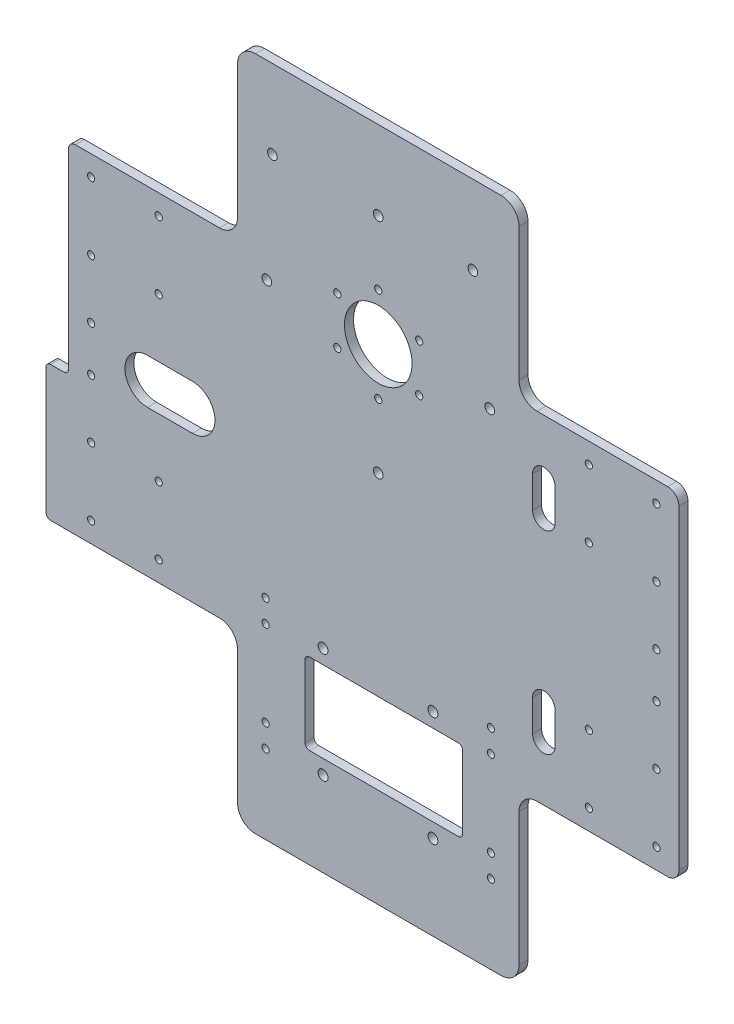
from build123d import *

# Parameters (mm, degrees)
SKETCH_281X300_10_R   = 1.6
SKETCH_281X300_10_R_2 = 15
SKETCH_281X300_10_R_3 = 2.15
SKETCH_281X300_10_R_4 = 2.2
F_4MM_DEPTH           = 4


with BuildPart() as part:
    # 底板轮廓_281x300_双槽内移10 → 凸台拉伸_4mm (new body)
    with BuildSketch(Plane.XY):
        with BuildLine():
            Line((-55.5, 83), (-55.5, 142))
            ThreePointArc((-55.5, 142), (-53.156854249, 147.656854249), (-47.5, 150))
            Line((-47.5, 150), (61.5, 150))
            ThreePointArc((61.5, 150), (67.156854249, 147.656854249), (69.5, 142))
            Line((69.5, 142), (69.5, 83))
            ThreePointArc((69.5, 83), (71.843145751, 77.343145751), (77.5, 75))
            Line((77.5, 75), (135.5, 75))
            ThreePointArc((135.5, 75), (139.035533906, 73.535533906), (140.5, 70))
            Line((140.5, 70), (140.5, -70))
            ThreePointArc((140.5, -70), (139.035533906, -73.535533906), (135.5, -75))
            Line((135.5, -75), (77.5, -75))
            ThreePointArc((77.5, -75), (71.843145751, -77.343145751), (69.5, -83))
            Line((69.5, -83), (69.5, -142))
            ThreePointArc((69.5, -142), (67.156854249, -147.656854249), (61.5, -150))
            Line((61.5, -150), (-47.5, -150))
            ThreePointArc((-47.5, -150), (-53.156854249, -147.656854249), (-55.5, -142))
            Line((-55.5, -142), (-55.5, -83))
            ThreePointArc((-55.5, -83), (-57.843145751, -77.343145751), (-63.5, -75))
            Line((-63.5, -75), (-138.5, -75))
            ThreePointArc((-138.5, -75), (-139.914213562, -74.414213562), (-140.5, -73))
            Line((-140.5, -73), (-140.5, -17))
            ThreePointArc((-140.5, -17), (-139.914213562, -15.585786438), (-138.5, -15))
            Line((-138.5, -15), (-132.5, -15))
            ThreePointArc((-132.5, -15), (-131.085786438, -14.414213562), (-130.5, -13))
            Line((-130.5, -13), (-130.5, 72))
            ThreePointArc((-130.5, 72), (-129.621320344, 74.121320344), (-127.5, 75))
            Line((-127.5, 75), (-63.5, 75))
            ThreePointArc((-63.5, 75), (-57.843145751, 77.343145751), (-55.5, 83))
        make_face()
        with Locations((100.5, -36)):
            Circle(SKETCH_281X300_10_R, mode=Mode.SUBTRACT)
        with Locations((130.5, -36)):
            Circle(SKETCH_281X300_10_R, mode=Mode.SUBTRACT)
        with Locations((100.5, 36)):
            Circle(SKETCH_281X300_10_R, mode=Mode.SUBTRACT)
        with Locations((7, 65.5)):
            Circle(SKETCH_281X300_10_R_2, mode=Mode.SUBTRACT)
        with Locations((7, 115)):
            Circle(SKETCH_281X300_10_R_3, mode=Mode.SUBTRACT)
        with Locations((-42.5, 65.5)):
            Circle(SKETCH_281X300_10_R_3, mode=Mode.SUBTRACT)
        with Locations((56.5, 65.5)):
            Circle(SKETCH_281X300_10_R_3, mode=Mode.SUBTRACT)
        with Locations((-40, 115)):
            Circle(SKETCH_281X300_10_R_3, mode=Mode.SUBTRACT)
        with Locations((130.5, 36)):
            Circle(SKETCH_281X300_10_R, mode=Mode.SUBTRACT)
        with Locations((49, 115)):
            Circle(SKETCH_281X300_10_R_3, mode=Mode.SUBTRACT)
        with Locations((7, 16)):
            Circle(SKETCH_281X300_10_R_3, mode=Mode.SUBTRACT)
        with Locations((31.290367902, -112.395183951)):
            Circle(SKETCH_281X300_10_R_4, mode=Mode.SUBTRACT)
        with Locations((-17.5, -112.395183951)):
            Circle(SKETCH_281X300_10_R_4, mode=Mode.SUBTRACT)
        with Locations((-17.5, -63.604816049)):
            Circle(SKETCH_281X300_10_R_4, mode=Mode.SUBTRACT)
        with Locations((31.290367902, -63.604816049)):
            Circle(SKETCH_281X300_10_R_4, mode=Mode.SUBTRACT)
        with Locations((7, 86.5)):
            Circle(SKETCH_281X300_10_R, mode=Mode.SUBTRACT)
        with Locations((25.186533479, 76)):
            Circle(SKETCH_281X300_10_R, mode=Mode.SUBTRACT)
        with Locations((100.5, -66)):
            Circle(SKETCH_281X300_10_R, mode=Mode.SUBTRACT)
        with Locations((25.186533479, 55)):
            Circle(SKETCH_281X300_10_R, mode=Mode.SUBTRACT)
        with Locations((100.5, 66)):
            Circle(SKETCH_281X300_10_R, mode=Mode.SUBTRACT)
        with Locations((7, 44.5)):
            Circle(SKETCH_281X300_10_R, mode=Mode.SUBTRACT)
        with Locations((130.5, 66)):
            Circle(SKETCH_281X300_10_R, mode=Mode.SUBTRACT)
        with Locations((130.5, -66)):
            Circle(SKETCH_281X300_10_R, mode=Mode.SUBTRACT)
        with Locations((-43, -105)):
            Circle(SKETCH_281X300_10_R, mode=Mode.SUBTRACT)
        with Locations((57, -57)):
            Circle(SKETCH_281X300_10_R, mode=Mode.SUBTRACT)
        with Locations((-43, -57)):
            Circle(SKETCH_281X300_10_R, mode=Mode.SUBTRACT)
        with Locations((57, -105)):
            Circle(SKETCH_281X300_10_R, mode=Mode.SUBTRACT)
        with Locations((-11.186533479, 55)):
            Circle(SKETCH_281X300_10_R, mode=Mode.SUBTRACT)
        with Locations((-11.186533479, 76)):
            Circle(SKETCH_281X300_10_R, mode=Mode.SUBTRACT)
        with Locations((130.5, 10)):
            Circle(SKETCH_281X300_10_R, mode=Mode.SUBTRACT)
        with Locations((130.5, -10)):
            Circle(SKETCH_281X300_10_R, mode=Mode.SUBTRACT)
        with Locations((-120.5, 10)):
            Circle(SKETCH_281X300_10_R, mode=Mode.SUBTRACT)
        with Locations((-120.5, -10)):
            Circle(SKETCH_281X300_10_R, mode=Mode.SUBTRACT)
        with Locations((-43, -115)):
            Circle(SKETCH_281X300_10_R, mode=Mode.SUBTRACT)
        with Locations((57, -67)):
            Circle(SKETCH_281X300_10_R, mode=Mode.SUBTRACT)
        with Locations((57, -115)):
            Circle(SKETCH_281X300_10_R, mode=Mode.SUBTRACT)
        with Locations((-43, -67)):
            Circle(SKETCH_281X300_10_R, mode=Mode.SUBTRACT)
        with Locations((-120.5, -66)):
            Circle(SKETCH_281X300_10_R, mode=Mode.SUBTRACT)
        with Locations((-90.5, -66)):
            Circle(SKETCH_281X300_10_R, mode=Mode.SUBTRACT)
        with Locations((-120.5, 66)):
            Circle(SKETCH_281X300_10_R, mode=Mode.SUBTRACT)
        with Locations((-90.5, 66)):
            Circle(SKETCH_281X300_10_R, mode=Mode.SUBTRACT)
        with Locations((-90.5, 36)):
            Circle(SKETCH_281X300_10_R, mode=Mode.SUBTRACT)
        with Locations((-120.5, 36)):
            Circle(SKETCH_281X300_10_R, mode=Mode.SUBTRACT)
        with Locations((-90.5, -36)):
            Circle(SKETCH_281X300_10_R, mode=Mode.SUBTRACT)
        with Locations((-120.5, -36)):
            Circle(SKETCH_281X300_10_R, mode=Mode.SUBTRACT)
        with BuildLine():
            Line((-25.5, -72), (-25.5, -104))
            ThreePointArc((-25.5, -104), (-24.914213562, -105.414213562), (-23.5, -106))
            Line((-23.5, -106), (42.5, -106))
            ThreePointArc((42.5, -106), (43.914213562, -105.414213562), (44.5, -104))
            Line((44.5, -104), (44.5, -72))
            ThreePointArc((44.5, -72), (43.914213562, -70.585786438), (42.5, -70))
            Line((42.5, -70), (-23.5, -70))
            ThreePointArc((-23.5, -70), (-24.914213562, -70.585786438), (-25.5, -72))
        make_face(mode=Mode.SUBTRACT)
        with BuildLine():
            Line((75.5, 50), (75.5, 36))
            ThreePointArc((75.5, 36), (80.5, 31), (85.5, 36))
            Line((85.5, 36), (85.5, 50))
            ThreePointArc((85.5, 50), (80.5, 55), (75.5, 50))
        make_face(mode=Mode.SUBTRACT)
        with BuildLine():
            Line((85.5, -50), (85.5, -36))
            ThreePointArc((85.5, -36), (80.5, -31), (75.5, -36))
            Line((75.5, -36), (75.5, -50))
            ThreePointArc((75.5, -50), (80.5, -55), (85.5, -50))
        make_face(mode=Mode.SUBTRACT)
        with BuildLine():
            Line((-95.5, -10), (-75.5, -10))
            ThreePointArc((-75.5, -10), (-65.5, 0), (-75.5, 10))
            Line((-75.5, 10), (-95.5, 10))
            ThreePointArc((-95.5, 10), (-105.5, 0), (-95.5, -10))
        make_face(mode=Mode.SUBTRACT)
    extrude(amount=F_4MM_DEPTH)


solid = part.part
